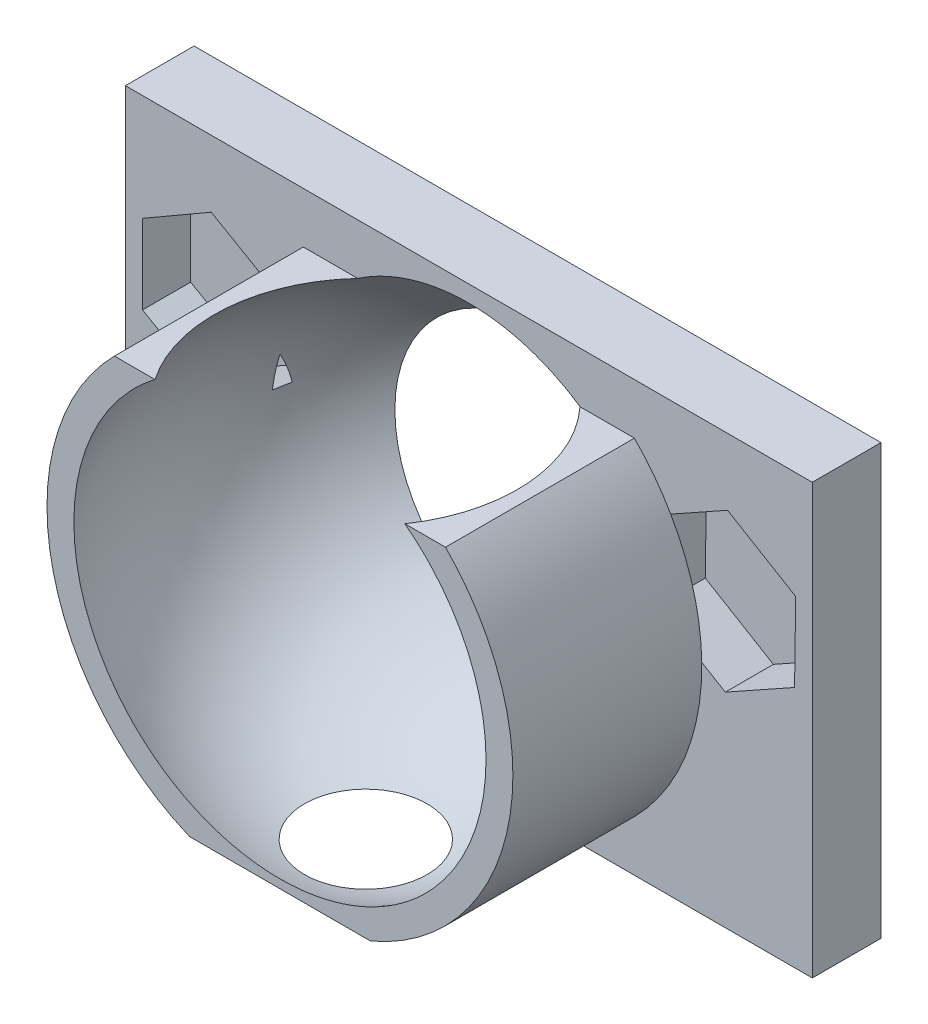
from build123d import *

# Parameters (mm, degrees)
CROQUIS1_W              = 40
CROQUIS1_H              = 25
SALIENTE_EXTRUIR2_DEPTH = 4
CORTAR_EXTRUIR1_DEPTH   = 2.8
CROQUIS3_R              = 7
SALIENTE_EXTRUIR3_DEPTH = 11
CROQUIS11_R             = 8.2
CORTAR_EXTRUIR3_DEPTH   = 9


with BuildPart() as part:
    # Croquis1 → Saliente-Extruir2 (new body)
    with BuildSketch(Plane.XY):
        with Locations((20, 12.5)):
            Rectangle(CROQUIS1_W, CROQUIS1_H)
    extrude(amount=SALIENTE_EXTRUIR2_DEPTH)

    # Croquis2 → Cortar-Extruir1 (cut)
    with BuildSketch(Plane.XY.offset(4)):
        Polygon((5, 11.881197846), (9, 14.190598923), (9, 18.809401077), (5, 21.118802154), (1, 18.809401077), (1, 14.190598923), align=None)
        Polygon((30.967302417, 14.249648614), (34.933782653, 11.883138976), (38.966480236, 14.134956805), (39.032697583, 18.753284273), (35.066217347, 21.119793911), (31.033519764, 18.867976082), align=None)
    extrude(amount=-CORTAR_EXTRUIR1_DEPTH, mode=Mode.SUBTRACT)

    # Croquis3 → Saliente-Extruir3 (add)
    with BuildSketch(Plane.XY.offset(4)):
        with BuildLine():
            Line((29.63920565, 22.043883614), (10.36079435, 22.043883614))
            ThreePointArc((10.36079435, 22.043883614), (6.694433275, 9.861459851), (14.732173124, 0))
            Line((14.732173124, 0), (25.267826876, 0))
            ThreePointArc((25.267826876, 0), (33.305566725, 9.861459851), (29.63920565, 22.043883614))
        make_face()
        with Locations((20, 12.5)):
            Circle(CROQUIS3_R, mode=Mode.SUBTRACT)
    extrude(amount=SALIENTE_EXTRUIR3_DEPTH)

    # Croquis8 → Cortar-Revolución3 (revolve, cut)
    with BuildSketch(Plane.XY.offset(10)):
        with BuildLine():
            Line((20, 25.5), (20, -0.5))
            ThreePointArc((20, -0.5), (7, 12.5), (20, 25.5))
        make_face()
    revolve(axis=Axis((20, 25.5, 10), (0, -1, 0)), mode=Mode.SUBTRACT)

    # Croquis11 → Cortar-Extruir3 (cut)
    with BuildSketch(Plane(origin=(0, 0, 0), x_dir=(-1, 0, 0), z_dir=(0, 0, -1))):
        with Locations((-20, 12.5)):
            Circle(CROQUIS11_R)
    extrude(amount=-CORTAR_EXTRUIR3_DEPTH, mode=Mode.SUBTRACT)


solid = part.part
